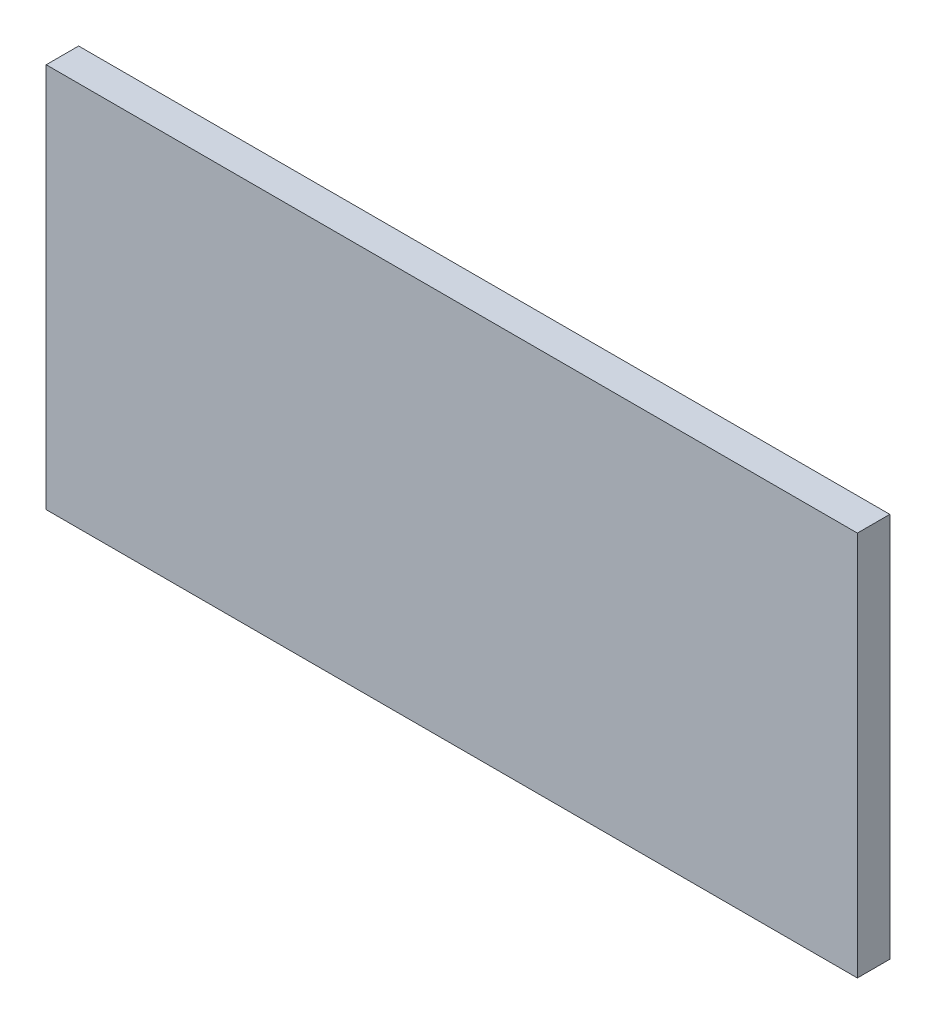
from build123d import *

# Parameters (mm, degrees)
SKETCH_1_W         = 40
SKETCH_1_H         = 19
BLOCKEXTRUDE_DEPTH = 1.6


with BuildPart() as part:
    # 草图1 → BlockExtrude (new body)
    with BuildSketch(Plane.XY):
        with Locations((20, 9.5)):
            Rectangle(SKETCH_1_W, SKETCH_1_H)
    extrude(amount=BLOCKEXTRUDE_DEPTH)


solid = part.part
